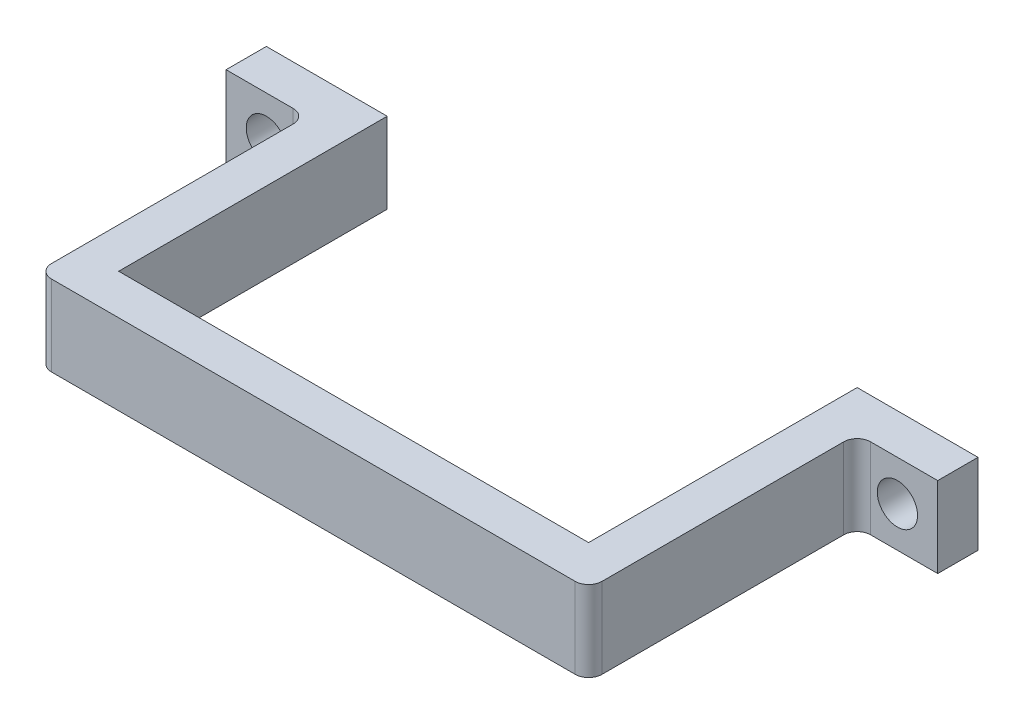
from build123d import *

# Parameters (mm, degrees)
SKETCH1_W           = 6
SKETCH1_H           = 3
SKETCH1_W_2         = 41
BOSS_EXTRUDE1_DEPTH = 6
SKETCH2_R           = 1.5
CUT_EXTRUDE1_DEPTH  = 6
FILLET1_R           = 1
FILLET2_R           = 1
FILLET3_R           = 1
FILLET4_R           = 1


with BuildPart() as part:
    # Sketch1 → Boss-Extrude1 (new body)
    with BuildSketch(Plane(origin=(0, 0, 0), x_dir=(1, 0, 0), z_dir=(0, 1, 0))):
        with Locations((-22.87164751, 20.478927203)):
            Rectangle(SKETCH1_W, SKETCH1_H)
        Polygon((-19.87164751, 18.978927203), (-19.87164751, 1.978927203), (-16.87164751, 1.978927203), (-16.87164751, 21.978927203), (-19.87164751, 21.978927203), align=None)
        with Locations((0.62835249, 0.478927203)):
            Rectangle(SKETCH1_W_2, SKETCH1_H)
        Polygon((18.12835249, 21.978927203), (18.12835249, 1.978927203), (21.12835249, 1.978927203), (21.12835249, 18.978927203), (21.12835249, 21.978927203), align=None)
        with Locations((24.12835249, 20.478927203)):
            Rectangle(SKETCH1_W, SKETCH1_H)
    extrude(amount=BOSS_EXTRUDE1_DEPTH)

    # Sketch2 → Cut-Extrude1 (cut)
    with BuildSketch(Plane.XY.offset(-18.978927203)):
        with Locations((-22.87164751, 3)):
            Circle(SKETCH2_R)
        with Locations((24.12835249, 3)):
            Circle(SKETCH2_R)
    extrude(amount=-CUT_EXTRUDE1_DEPTH, mode=Mode.SUBTRACT)

    # Fillet1
    fillet1_edges = [part.edges().sort_by_distance(p)[0] for p in [
        (-19.87164751, 3, -18.978927203),
    ]]
    fillet(fillet1_edges, radius=FILLET1_R)

    # Fillet2
    fillet2_edges = [part.edges().sort_by_distance(p)[0] for p in [
        (21.12835249, 3, -18.978927203),
    ]]
    fillet(fillet2_edges, radius=FILLET2_R)

    # Fillet3
    fillet3_edges = [part.edges().sort_by_distance(p)[0] for p in [
        (21.12835249, 3, 1.021072797),
    ]]
    fillet(fillet3_edges, radius=FILLET3_R)

    # Fillet4
    fillet4_edges = [part.edges().sort_by_distance(p)[0] for p in [
        (-19.87164751, 3, 1.021072797),
    ]]
    fillet(fillet4_edges, radius=FILLET4_R)


solid = part.part
